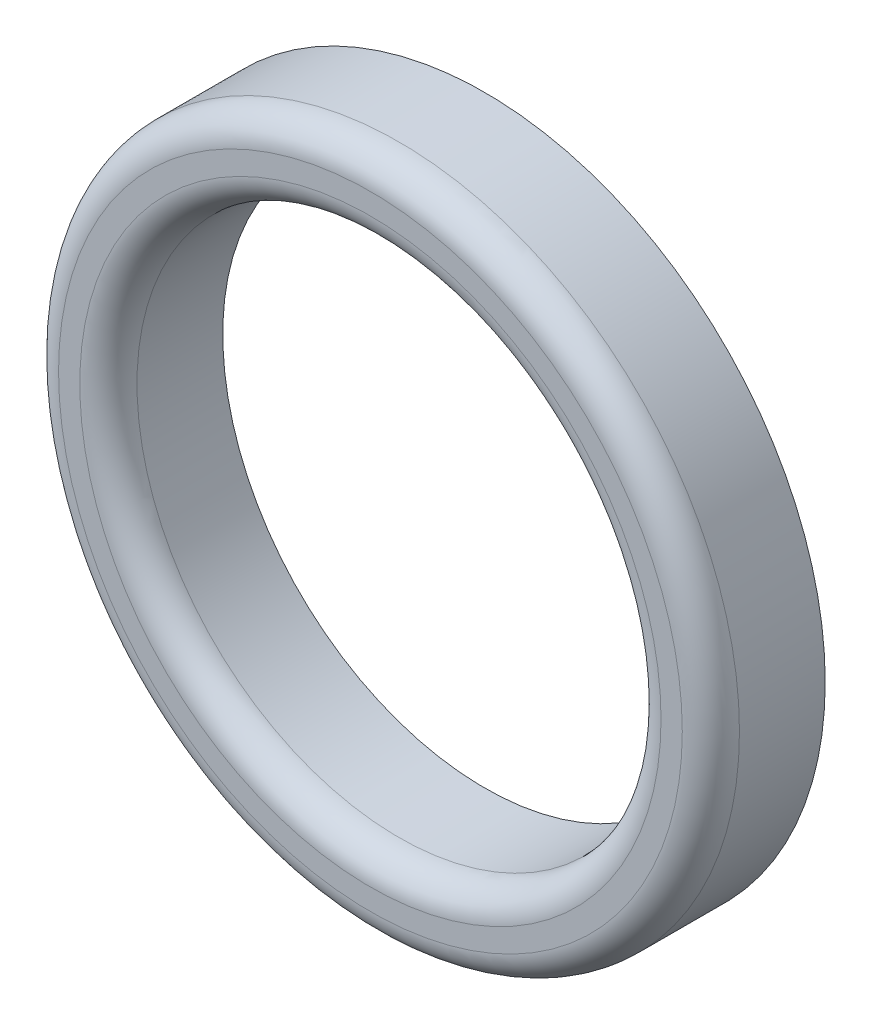
from build123d import *

# Parameters (mm, degrees)
SKETCH1_R           = 35.73
SKETCH1_R_2         = 27.5
BOSS_EXTRUDE1_DEPTH = 12
FILLET1_R           = 3
SHELL1_T            = -1


with BuildPart() as part:
    # Sketch1 → Boss-Extrude1 (new body)
    with BuildSketch(Plane.XY):
        Circle(SKETCH1_R)
        Circle(SKETCH1_R_2, mode=Mode.SUBTRACT)
    extrude(amount=BOSS_EXTRUDE1_DEPTH)

    # Fillet1
    fillet1_edges = [part.edges().sort_by_distance(p)[0] for p in [
        (-35.73, 0, 12),
        (-27.5, 0, 12),
    ]]
    fillet(fillet1_edges, radius=FILLET1_R)

    # Shell1
    shell1_openings = [part.faces().sort_by_distance(p)[0] for p in [
        (-34.719402988, 0, 0),
    ]]
    offset(amount=SHELL1_T, openings=shell1_openings, kind=Kind.INTERSECTION)


solid = part.part
